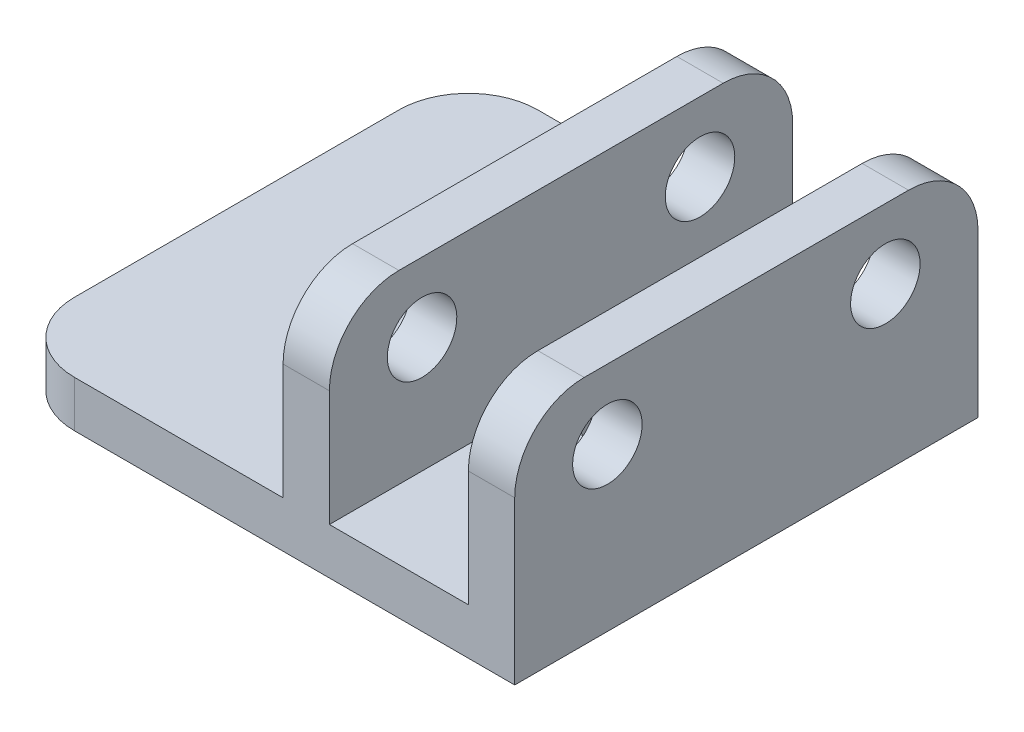
from build123d import *

# Parameters (mm, degrees)
BOSS_EXTRUDE1_DEPTH = 20
FILLET1_R           = 3
SKETCH2_R           = 1.5
CUT_EXTRUDE1_DEPTH  = 20
SKETCH3_R           = 1.5
CUT_EXTRUDE2_DEPTH  = 20


with BuildPart() as part:
    # Sketch1 → Boss-Extrude1 (new body)
    with BuildSketch(Plane.XY):
        Polygon((5, 0), (-17, 0), (-17, 2), (-5, 2), (-5, 10), (-3, 10), (-3, 2), (3, 2), (3, 10), (5, 10), align=None)
    extrude(amount=BOSS_EXTRUDE1_DEPTH)

    # Fillet1
    fillet1_edges = [part.edges().sort_by_distance(p)[0] for p in [
        (4, 10, 0),
        (-17, 1, 0),
        (-4, 10, 0),
        (-4, 10, 20),
        (-17, 1, 20),
        (4, 10, 20),
    ]]
    fillet(fillet1_edges, radius=FILLET1_R)

    # Sketch2 → Cut-Extrude1 (cut)
    with BuildSketch(Plane.ZY.offset(5)):
        with Locations(Location((16, 7, 0), (0, 0, 270))):
            Circle(SKETCH2_R)
        with Locations(Location((4, 7, 0), (0, 0, 270))):
            Circle(SKETCH2_R)
    extrude(amount=-CUT_EXTRUDE1_DEPTH, mode=Mode.SUBTRACT)

    # Sketch3 → Cut-Extrude2 (cut)
    with BuildSketch(Plane(origin=(0, 2, 0), x_dir=(1, 0, 0), z_dir=(0, 1, 0))):
        with Locations(Location((0, -10, 0), (0, 0, 180))):
            Circle(SKETCH3_R)
    extrude(amount=-CUT_EXTRUDE2_DEPTH, mode=Mode.SUBTRACT)


solid = part.part
